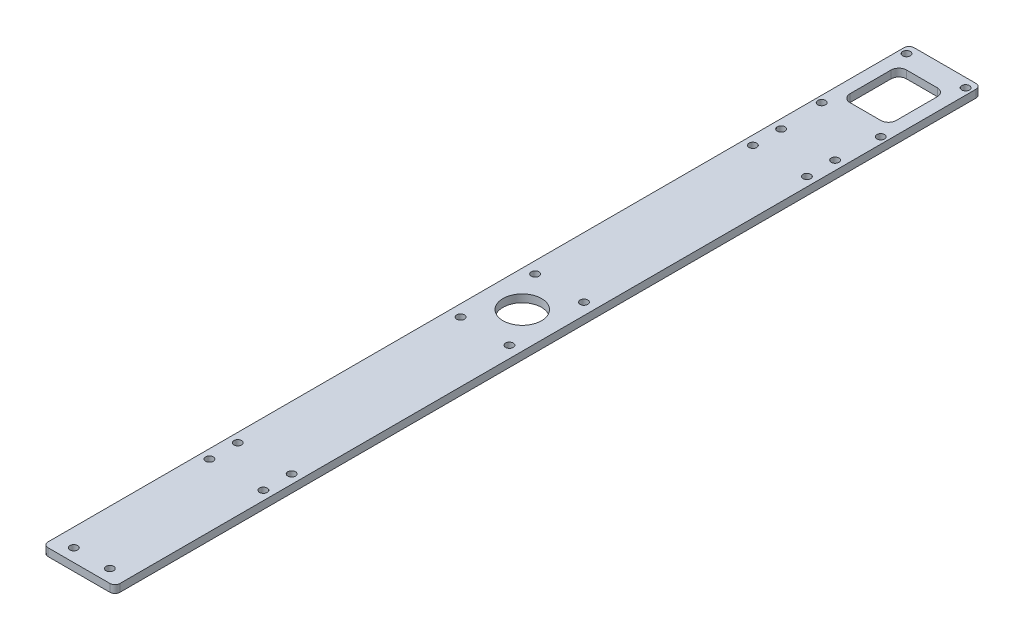
from build123d import *

# Parameters (mm, degrees)
SKETCH_1_W             = 28
SKETCH_1_H             = 3
EXTRUDE_1_DEPTH        = 337
SKETCH_2_R             = 7.5
SKETCH_2_R_2           = 1.5
CUT_EXTRUDE_1_DEPTH    = 400
SKETCH_3_R             = 1.5
SKETCH_3_W             = 18
SKETCH_3_H             = 22
CUT_EXTRUDE_2_DEPTH    = 10
SKETCH_4_R             = 1.5
CUT_EXTRUDE_3_DEPTH    = 10
SKETCH_5_R             = 1.5
CUT_EXTRUDE_4_DEPTH    = 10
FILLET_1_R             = 2
FILLET_3_R             = 3
PATTERN_LINEAR_1_COUNT = 2
PATTERN_LINEAR_1_PITCH = 211.46


with BuildPart() as part:
    # 草图1 → 凸台-拉伸1 (new body)
    with BuildSketch(Plane.XY):
        Rectangle(SKETCH_1_W, SKETCH_1_H)
    extrude(amount=EXTRUDE_1_DEPTH)

    # 草图2 → 切除-拉伸1 (cut)
    with BuildSketch(Plane.XZ.offset(1.5)):
        with Locations((0, 164.5)):
            Circle(SKETCH_2_R)
        with Locations((-9.5, 179)):
            Circle(SKETCH_2_R_2)
        with Locations((9.5, 179)):
            Circle(SKETCH_2_R_2)
        with Locations((9.5, 150)):
            Circle(SKETCH_2_R_2)
        with Locations((-9.5, 150)):
            Circle(SKETCH_2_R_2)
    extrude(amount=-CUT_EXTRUDE_1_DEPTH, mode=Mode.SUBTRACT)

    # 草图3 → 切除-拉伸2 (cut)
    with BuildSketch(Plane(origin=(0, 1.5, 0), x_dir=(1, 0, 0), z_dir=(0, 1, 0))):
        with Locations(Location((11.5, -3.5, 0), (0, 0, 180))):
            Circle(SKETCH_3_R)
        with Locations(Location((-11.5, -3.5, 0), (0, 0, 180))):
            Circle(SKETCH_3_R)
        with Locations(Location((-11.5, -36.5, 0), (0, 0, 180))):
            Circle(SKETCH_3_R)
        with Locations(Location((11.5, -36.5, 0), (0, 0, 180))):
            Circle(SKETCH_3_R)
        with Locations((0, -20)):
            Rectangle(SKETCH_3_W, SKETCH_3_H)
    extrude(amount=-CUT_EXTRUDE_2_DEPTH, mode=Mode.SUBTRACT)

    # 草图4 → 切除-拉伸3 (cut)
    with BuildSketch(Plane(origin=(0, 1.5, 0), x_dir=(1, 0, 0), z_dir=(0, 1, 0))):
        with Locations(Location((7, -332, 0), (0, 0, 180))):
            Circle(SKETCH_4_R)
        with Locations(Location((-7, -332, 0), (0, 0, 180))):
            Circle(SKETCH_4_R)
    extrude(amount=-CUT_EXTRUDE_3_DEPTH, mode=Mode.SUBTRACT)

    # 草图5 → 切除-拉伸4 (cut)
    with BuildSketch(Plane.XZ.offset(1.5)):
        with Locations((-10.5, 264.73)):
            Circle(SKETCH_5_R)
        with Locations((-10.5, 275.73)):
            Circle(SKETCH_5_R)
        with Locations((10.5, 275.73)):
            Circle(SKETCH_5_R)
        with Locations((10.5, 264.73)):
            Circle(SKETCH_5_R)
    cut_extrude_4 = extrude(amount=-CUT_EXTRUDE_4_DEPTH, mode=Mode.SUBTRACT)

    # 圆角1
    fillet_1_edges = [part.edges().sort_by_distance(p)[0] for p in [
        (-14, 0, 337),
        (14, 0, 337),
        (-14, 0, 0),
        (14, 0, 0),
    ]]
    fillet(fillet_1_edges, radius=FILLET_1_R)

    # 圆角3
    fillet_3_edges = [part.edges().sort_by_distance(p)[0] for p in [
        (9, 0, 9),
        (9, 0, 31),
        (-9, 0, 31),
        (-9, 0, 9),
    ]]
    fillet(fillet_3_edges, radius=FILLET_3_R)

    # 阵列(线性)1: 切除-拉伸4 ×2
    with Locations(*[(0, 0, -i * PATTERN_LINEAR_1_PITCH) for i in range(1, PATTERN_LINEAR_1_COUNT)]):
        add(cut_extrude_4, mode=Mode.SUBTRACT)


solid = part.part
